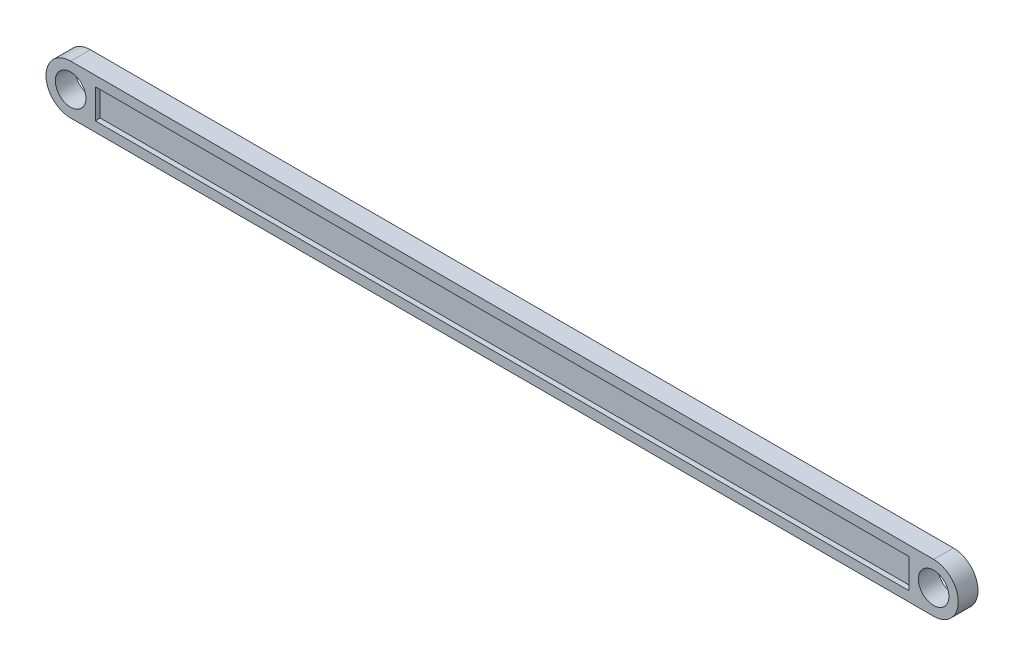
from build123d import *

# Parameters (mm, degrees)
CROQUIS1_R              = 3.1
SALIENTE_EXTRUIR1_DEPTH = 4
CROQUIS2_W              = 165
CROQUIS2_H              = 6
CORTAR_EXTRUIR1_DEPTH   = 1
CROQUIS3_W              = 165
CROQUIS3_H              = 6
CORTAR_EXTRUIR2_DEPTH   = 1


with BuildPart() as part:
    # Croquis1 → Saliente-Extruir1 (new body)
    with BuildSketch(Plane.XY):
        with BuildLine():
            Line((0, 5), (175, 5))
            ThreePointArc((175, 5), (180, 0), (175, -5))
            Line((175, -5), (0, -5))
            ThreePointArc((0, -5), (-5, 0), (0, 5))
        make_face()
        Circle(CROQUIS1_R, mode=Mode.SUBTRACT)
        with Locations((175, 0)):
            Circle(CROQUIS1_R, mode=Mode.SUBTRACT)
    extrude(amount=SALIENTE_EXTRUIR1_DEPTH)

    # Croquis2 → Cortar-Extruir1 (cut)
    with BuildSketch(Plane.XY.offset(4)):
        with Locations((87.5, 0)):
            Rectangle(CROQUIS2_W, CROQUIS2_H)
    extrude(amount=-CORTAR_EXTRUIR1_DEPTH, mode=Mode.SUBTRACT)

    # Croquis3 → Cortar-Extruir2 (cut)
    with BuildSketch(Plane(origin=(0, 0, 0), x_dir=(-1, 0, 0), z_dir=(0, 0, -1))):
        with Locations((-87.5, 0)):
            Rectangle(CROQUIS3_W, CROQUIS3_H)
    extrude(amount=-CORTAR_EXTRUIR2_DEPTH, mode=Mode.SUBTRACT)


solid = part.part
